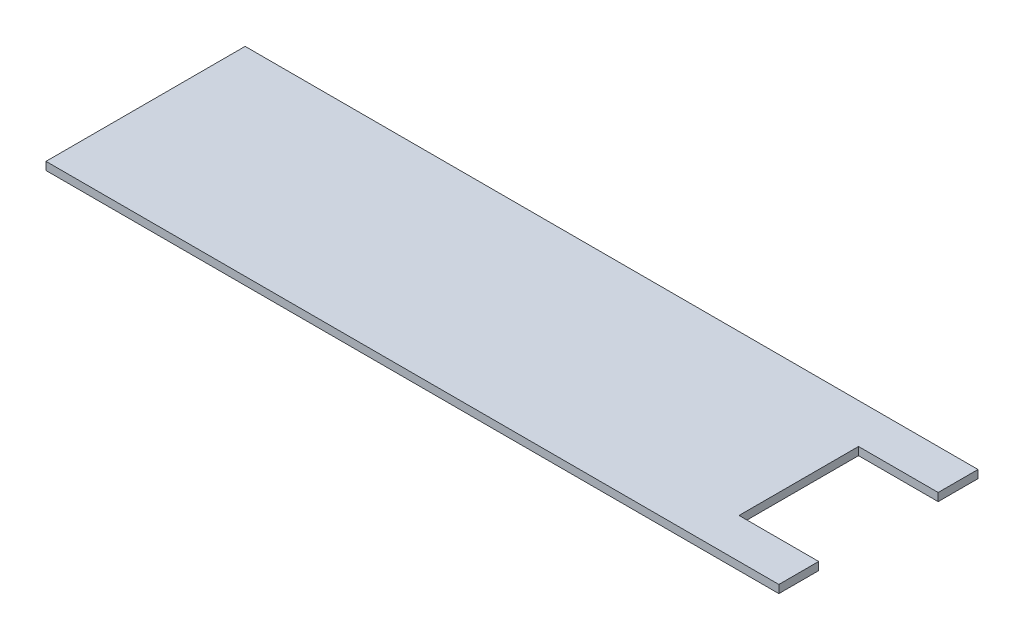
from build123d import *

# Parameters (mm, degrees)
SKETCH_1_W          = 92
SKETCH_1_H          = 25
EXTRUDE_1_DEPTH     = 1
SKETCH_2_W          = 10
SKETCH_2_H          = 15
CUT_EXTRUDE_1_DEPTH = 1


with BuildPart() as part:
    # 草图1 → 凸台-拉伸1 (new body)
    with BuildSketch(Plane(origin=(0, 0, 0), x_dir=(1, 0, 0), z_dir=(0, 1, 0))):
        with Locations((-8.403846154, 1.634615385)):
            Rectangle(SKETCH_1_W, SKETCH_1_H)
    extrude(amount=EXTRUDE_1_DEPTH)

    # 草图2 → 切除-拉伸1 (cut)
    with BuildSketch(Plane(origin=(0, 1, 0), x_dir=(1, 0, 0), z_dir=(0, 1, 0))):
        with Locations((32.596153846, 1.634615385)):
            Rectangle(SKETCH_2_W, SKETCH_2_H)
    extrude(amount=-CUT_EXTRUDE_1_DEPTH, mode=Mode.SUBTRACT)


solid = part.part
